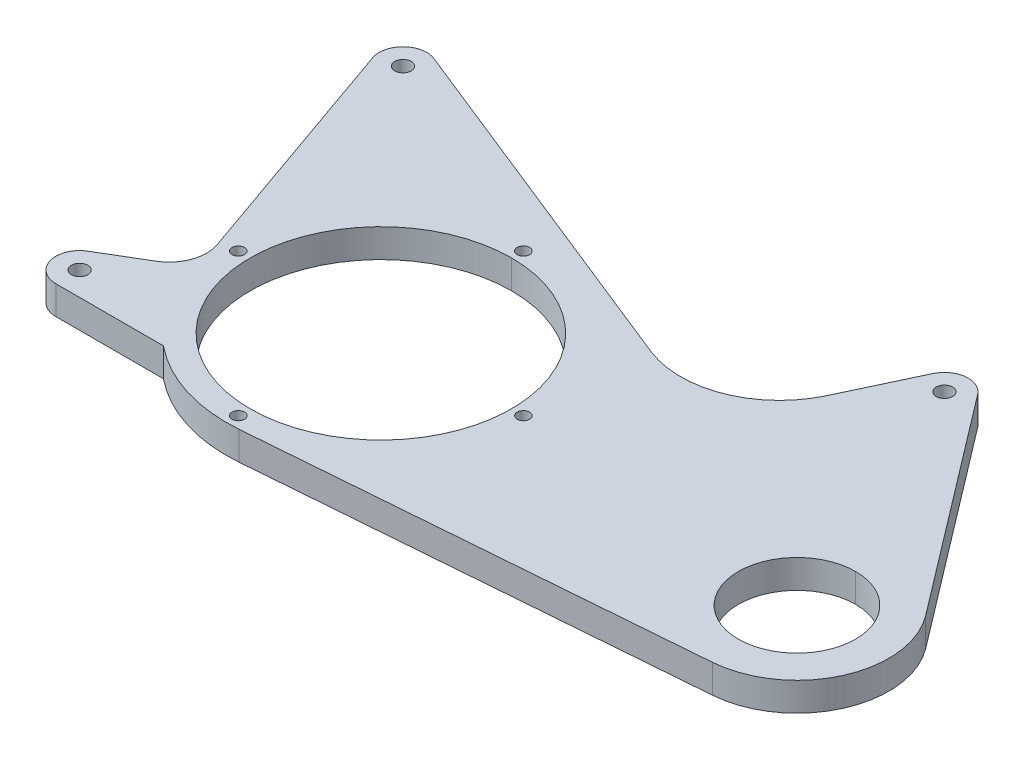
from build123d import *

# Parameters (mm, degrees)
SKETCH1_R             = 52.3875
SKETCH1_R_2           = 23.5
BOSS_EXTRUDE1_DEPTH   = 11.43
M6_CLEARANCE_HOLE1_D  = 6.6
F_5_0MM_DOWEL_HOLE1_D = 5
CIRPATTERN1_COUNT     = 4


with BuildPart() as part:
    # Sketch1 → Boss-Extrude1 (new body)
    with BuildSketch(Plane(origin=(0, 0, 0), x_dir=(1, 0, 0), z_dir=(0, 1, 0))):
        with BuildLine():
            Line((-205.575185514, -163.900359311), (-162.418239385, -163.900359311))
            ThreePointArc((-162.418239385, -163.900359311), (-141.68491097, -175.086974107), (-118.273664056, -177.718470957))
            Line((-118.273664056, -177.718470957), (57.534589587, -163.713698748))
            ThreePointArc((57.534589587, -163.713698748), (88.232990974, -142.03141304), (83.918702981, -104.696439083))
            Line((83.918702981, -104.696439083), (17.613541845, -17.566035058))
            ThreePointArc((17.613541845, -17.566035058), (9.029109122, -13.862322556), (1.412558245, -19.284326264))
            Line((1.412558245, -19.284326264), (-12.176603989, -48.212200061))
            ThreePointArc((-12.176603989, -48.212200061), (-33.518744337, -68.231765471), (-62.780706514, -68.14502812))
            Line((-62.780706514, -68.14502812), (-207.974881785, -9.956762437))
            ThreePointArc((-207.974881785, -9.956762437), (-218.104712161, -11.917535088), (-220.5058623, -21.95210388))
            Line((-220.5058623, -21.95210388), (-186.782347933, -118.053350031))
            ThreePointArc((-186.782347933, -118.053350031), (-186.837480234, -128.184816063), (-193.296838451, -135.990348392))
            Line((-193.296838451, -135.990348392), (-210.444169906, -146.188869465))
            ThreePointArc((-210.444169906, -146.188869465), (-214.759463951, -156.900167147), (-205.575185514, -163.900359311))
        make_face()
        with Locations(Location((-123.19, -116.001477372, 0), (0, 0, 270))):
            Circle(SKETCH1_R, mode=Mode.SUBTRACT)
        with Locations(Location((54.61, -127, 0), (0, 0, 270))):
            Circle(SKETCH1_R_2, mode=Mode.SUBTRACT)
    extrude(amount=BOSS_EXTRUDE1_DEPTH)

    # M6 Clearance Hole1 (through all)
    with Locations(Plane(origin=(0, 0, 0), x_dir=(-1, 0, 0), z_dir=(0, -1, 0))):
        with Locations((-10.033704867, -23.334197365), (211.518182886, -18.798178744), (205.575185514, -154.375359311)):
            Hole(M6_CLEARANCE_HOLE1_D / 2)

    # Ø5.0mm Dowel Hole1 (through all)
    with Locations(Plane(origin=(0, 0, 0), x_dir=(-1, 0, 0), z_dir=(0, -1, 0))):
        with Locations((123.19, -173.151477372)):
            f_5_0mm_dowel_hole1 = Hole(F_5_0MM_DOWEL_HOLE1_D / 2)

    # CirPattern1: Ø5.0mm Dowel Hole1 ×4 about axis
    cirpattern1_axis = Axis((-123.19, 0, 116.001477372), (0, 1, 0))
    for i in range(1, CIRPATTERN1_COUNT):
        add(f_5_0mm_dowel_hole1.rotate(cirpattern1_axis, i * 360 / CIRPATTERN1_COUNT), mode=Mode.SUBTRACT)


solid = part.part
